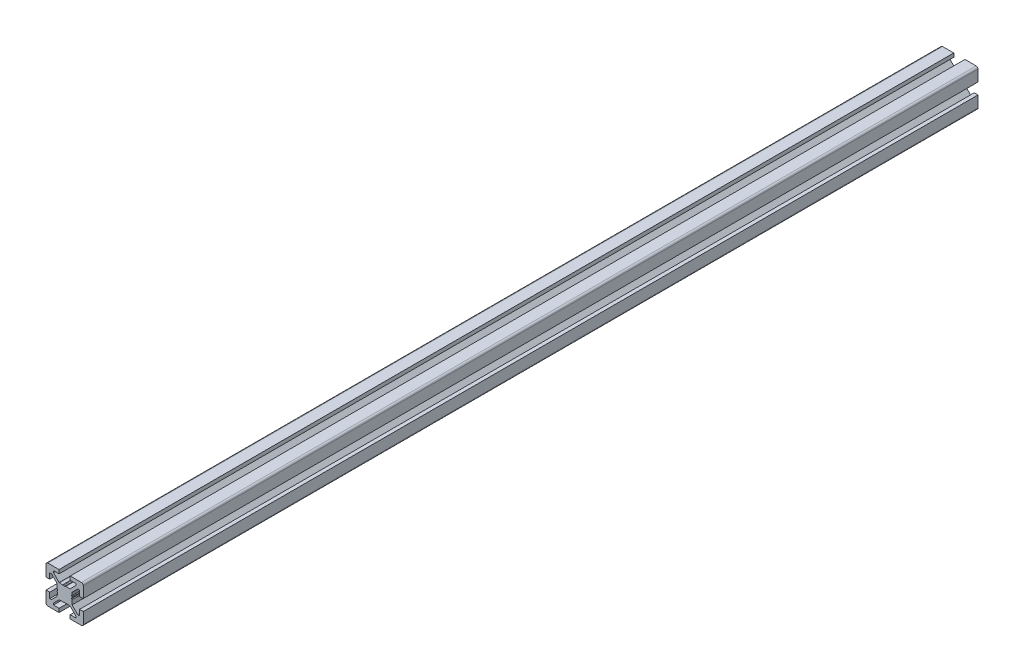
from build123d import *

# Parameters (mm, degrees)
SKETCH1_R           = 2.1
BOSS_EXTRUDE1_DEPTH = 400
EXTRUDE_1_DEPTH     = 20
EXTRUDE_2_DEPTH     = 60


with BuildPart() as part:
    # Sketch1 → Boss-Extrude1 (new body)
    with BuildSketch(Plane(origin=(0, 0, -2000), x_dir=(-1, 0, 0), z_dir=(0, 0, -1))):
        with BuildLine():
            Line((10, -3), (8, -3))
            Line((8, -3), (8, -6))
            Line((8, -6), (7.060660172, -6))
            Line((7.060660172, -6), (4, -2.939339828))
            Line((4, -2.939339828), (4, -2.5))
            Line((4, -2.5), (3.750976592, -1.218885629))
            Line((3.750976592, -1.218885629), (3.933012702, -0.903589838))
            ThreePointArc((3.933012702, -0.903589838), (4, -0.653589838), (3.933012702, -0.403589838))
            Line((3.933012702, -0.403589838), (3.7, 0))
            Line((3.7, 0), (3.933012702, 0.403589838))
            ThreePointArc((3.933012702, 0.403589838), (3.982962913, 0.524180316), (4, 0.653589838))
            Line((4, 0.653589838), (4, 2.939339828))
            Line((4, 2.939339828), (7.060660172, 6))
            Line((7.060660172, 6), (8, 6))
            Line((8, 6), (8, 3))
            Line((8, 3), (10, 3))
            Line((10, 3), (10, 9))
            ThreePointArc((10, 9), (9.707106781, 9.707106781), (9, 10))
            Line((9, 10), (3, 10))
            Line((3, 10), (3, 8))
            Line((3, 8), (6, 8))
            Line((6, 8), (6, 7.060660172))
            Line((6, 7.060660172), (2.939339828, 4))
            Line((2.939339828, 4), (2.5, 4))
            Line((2.5, 4), (1.218885629, 3.750976592))
            Line((1.218885629, 3.750976592), (0.903589838, 3.933012702))
            ThreePointArc((0.903589838, 3.933012702), (0.653589838, 4), (0.403589838, 3.933012702))
            Line((0.403589838, 3.933012702), (0, 3.7))
            Line((0, 3.7), (-0.403589838, 3.933012702))
            ThreePointArc((-0.403589838, 3.933012702), (-0.524180316, 3.982962913), (-0.653589838, 4))
            Line((-0.653589838, 4), (-2.939339828, 4))
            Line((-2.939339828, 4), (-6, 7.060660172))
            Line((-6, 7.060660172), (-6, 8))
            Line((-6, 8), (-3, 8))
            Line((-3, 8), (-3, 10))
            Line((-3, 10), (-9, 10))
            ThreePointArc((-9, 10), (-9.707106781, 9.707106781), (-10, 9))
            Line((-10, 9), (-10, 3))
            Line((-10, 3), (-8, 3))
            Line((-8, 3), (-8, 6))
            Line((-8, 6), (-7.060660172, 6))
            Line((-7.060660172, 6), (-4, 2.939339828))
            Line((-4, 2.939339828), (-4, 2.5))
            Line((-4, 2.5), (-3.750976592, 1.218885629))
            Line((-3.750976592, 1.218885629), (-3.933012702, 0.903589838))
            ThreePointArc((-3.933012702, 0.903589838), (-4, 0.653589838), (-3.933012702, 0.403589838))
            Line((-3.933012702, 0.403589838), (-3.7, 0))
            Line((-3.7, 0), (-3.933012702, -0.403589838))
            ThreePointArc((-3.933012702, -0.403589838), (-3.982962913, -0.524180316), (-4, -0.653589838))
            Line((-4, -0.653589838), (-4, -2.939339828))
            Line((-4, -2.939339828), (-7.060660172, -6))
            Line((-7.060660172, -6), (-8, -6))
            Line((-8, -6), (-8, -3))
            Line((-8, -3), (-10, -3))
            Line((-10, -3), (-10, -9))
            ThreePointArc((-10, -9), (-9.707106781, -9.707106781), (-9, -10))
            Line((-9, -10), (-3, -10))
            Line((-3, -10), (-3, -8))
            Line((-3, -8), (-6, -8))
            Line((-6, -8), (-6, -7.060660172))
            Line((-6, -7.060660172), (-2.939339828, -4))
            Line((-2.939339828, -4), (-2.5, -4))
            Line((-2.5, -4), (-1.218885629, -3.750976592))
            Line((-1.218885629, -3.750976592), (-0.903589838, -3.933012702))
            ThreePointArc((-0.903589838, -3.933012702), (-0.653589838, -4), (-0.403589838, -3.933012702))
            Line((-0.403589838, -3.933012702), (0, -3.7))
            Line((0, -3.7), (0.403589838, -3.933012702))
            ThreePointArc((0.403589838, -3.933012702), (0.524180316, -3.982962913), (0.653589838, -4))
            Line((0.653589838, -4), (2.939339828, -4))
            Line((2.939339828, -4), (6, -7.060660172))
            Line((6, -7.060660172), (6, -8))
            Line((6, -8), (3, -8))
            Line((3, -8), (3, -10))
            Line((3, -10), (9, -10))
            ThreePointArc((9, -10), (9.707106781, -9.707106781), (10, -9))
            Line((10, -9), (10, -3))
        make_face()
        with Locations(Location((0, 0, 0), (0, 0, 180))):
            Circle(SKETCH1_R, mode=Mode.SUBTRACT)
    extrude(amount=-BOSS_EXTRUDE1_DEPTH)

    # 草图1 → 凸台-拉伸1 (add)
    with BuildSketch(Plane.XY.offset(-1600)):
        with BuildLine():
            Line((-10, -3), (-10, -9))
            ThreePointArc((-10, -9), (-9.707106781, -9.707106781), (-9, -10))
            Line((-9, -10), (-3, -10))
            Line((-3, -10), (-3, -8))
            Line((-3, -8), (-6, -8))
            Line((-6, -8), (-6, -7.060660172))
            Line((-6, -7.060660172), (-2.939339828, -4))
            Line((-2.939339828, -4), (-0.653589838, -4))
            ThreePointArc((-0.653589838, -4), (-0.524180316, -3.982962913), (-0.403589838, -3.933012702))
            Line((-0.403589838, -3.933012702), (0, -3.7))
            Line((0, -3.7), (0.403589838, -3.933012702))
            ThreePointArc((0.403589838, -3.933012702), (0.653589838, -4), (0.903589838, -3.933012702))
            Line((0.903589838, -3.933012702), (1.218885629, -3.750976592))
            Line((1.218885629, -3.750976592), (2.5, -4))
            Line((2.5, -4), (2.939339828, -4))
            Line((2.939339828, -4), (6, -7.060660172))
            Line((6, -7.060660172), (6, -8))
            Line((6, -8), (3, -8))
            Line((3, -8), (3, -10))
            Line((3, -10), (9, -10))
            ThreePointArc((9, -10), (9.707106781, -9.707106781), (10, -9))
            Line((10, -9), (10, -3))
            Line((10, -3), (8, -3))
            Line((8, -3), (8, -6))
            Line((8, -6), (7.060660172, -6))
            Line((7.060660172, -6), (4, -2.939339828))
            Line((4, -2.939339828), (4, -0.653589838))
            ThreePointArc((4, -0.653589838), (3.982962913, -0.524180316), (3.933012702, -0.403589838))
            Line((3.933012702, -0.403589838), (3.7, 0))
            Line((3.7, 0), (3.933012702, 0.403589838))
            ThreePointArc((3.933012702, 0.403589838), (4, 0.653589838), (3.933012702, 0.903589838))
            Line((3.933012702, 0.903589838), (3.750976592, 1.218885629))
            Line((3.750976592, 1.218885629), (4, 2.5))
            Line((4, 2.5), (4, 2.939339828))
            Line((4, 2.939339828), (7.060660172, 6))
            Line((7.060660172, 6), (8, 6))
            Line((8, 6), (8, 3))
            Line((8, 3), (10, 3))
            Line((10, 3), (10, 9))
            ThreePointArc((10, 9), (9.707106781, 9.707106781), (9, 10))
            Line((9, 10), (3, 10))
            Line((3, 10), (3, 8))
            Line((3, 8), (6, 8))
            Line((6, 8), (6, 7.060660172))
            Line((6, 7.060660172), (2.939339828, 4))
            Line((2.939339828, 4), (0.653589838, 4))
            ThreePointArc((0.653589838, 4), (0.524180316, 3.982962913), (0.403589838, 3.933012702))
            Line((0.403589838, 3.933012702), (0, 3.7))
            Line((0, 3.7), (-0.403589838, 3.933012702))
            ThreePointArc((-0.403589838, 3.933012702), (-0.653589838, 4), (-0.903589838, 3.933012702))
            Line((-0.903589838, 3.933012702), (-1.218885629, 3.750976592))
            Line((-1.218885629, 3.750976592), (-2.5, 4))
            Line((-2.5, 4), (-2.939339828, 4))
            Line((-2.939339828, 4), (-6, 7.060660172))
            Line((-6, 7.060660172), (-6, 8))
            Line((-6, 8), (-3, 8))
            Line((-3, 8), (-3, 10))
            Line((-3, 10), (-9, 10))
            ThreePointArc((-9, 10), (-9.707106781, 9.707106781), (-10, 9))
            Line((-10, 9), (-10, 3))
            Line((-10, 3), (-8, 3))
            Line((-8, 3), (-8, 6))
            Line((-8, 6), (-7.060660172, 6))
            Line((-7.060660172, 6), (-4, 2.939339828))
            Line((-4, 2.939339828), (-4, 0.653589838))
            ThreePointArc((-4, 0.653589838), (-3.982962913, 0.524180316), (-3.933012702, 0.403589838))
            Line((-3.933012702, 0.403589838), (-3.7, 0))
            Line((-3.7, 0), (-3.933012702, -0.403589838))
            ThreePointArc((-3.933012702, -0.403589838), (-4, -0.653589838), (-3.933012702, -0.903589838))
            Line((-3.933012702, -0.903589838), (-3.750976592, -1.218885629))
            Line((-3.750976592, -1.218885629), (-4, -2.5))
            Line((-4, -2.5), (-4, -2.939339828))
            Line((-4, -2.939339828), (-7.060660172, -6))
            Line((-7.060660172, -6), (-8, -6))
            Line((-8, -6), (-8, -3))
            Line((-8, -3), (-10, -3))
        make_face()
    extrude(amount=EXTRUDE_1_DEPTH)

    # 草图2 → 凸台-拉伸2 (add)
    with BuildSketch(Plane.XY.offset(-1580)):
        with BuildLine():
            Line((-9, -10), (-3, -10))
            Line((-3, -10), (-3, -8))
            Line((-3, -8), (-6, -8))
            Line((-6, -8), (-6, -7.060660172))
            Line((-6, -7.060660172), (-2.939339828, -4))
            Line((-2.939339828, -4), (-0.653589838, -4))
            ThreePointArc((-0.653589838, -4), (-0.524180316, -3.982962913), (-0.403589838, -3.933012702))
            Line((-0.403589838, -3.933012702), (0, -3.7))
            Line((0, -3.7), (0.403589838, -3.933012702))
            ThreePointArc((0.403589838, -3.933012702), (0.653589838, -4), (0.903589838, -3.933012702))
            Line((0.903589838, -3.933012702), (1.218885629, -3.750976592))
            Line((1.218885629, -3.750976592), (2.5, -4))
            Line((2.5, -4), (2.939339828, -4))
            Line((2.939339828, -4), (6, -7.060660172))
            Line((6, -7.060660172), (6, -8))
            Line((6, -8), (3, -8))
            Line((3, -8), (3, -10))
            Line((3, -10), (9, -10))
            ThreePointArc((9, -10), (9.707106781, -9.707106781), (10, -9))
            Line((10, -9), (10, -3))
            Line((10, -3), (8, -3))
            Line((8, -3), (8, -6))
            Line((8, -6), (7.060660172, -6))
            Line((7.060660172, -6), (4, -2.939339828))
            Line((4, -2.939339828), (4, -0.653589838))
            ThreePointArc((4, -0.653589838), (3.982962913, -0.524180316), (3.933012702, -0.403589838))
            Line((3.933012702, -0.403589838), (3.7, 0))
            Line((3.7, 0), (3.933012702, 0.403589838))
            ThreePointArc((3.933012702, 0.403589838), (4, 0.653589838), (3.933012702, 0.903589838))
            Line((3.933012702, 0.903589838), (3.750976592, 1.218885629))
            Line((3.750976592, 1.218885629), (4, 2.5))
            Line((4, 2.5), (4, 2.939339828))
            Line((4, 2.939339828), (7.060660172, 6))
            Line((7.060660172, 6), (8, 6))
            Line((8, 6), (8, 3))
            Line((8, 3), (10, 3))
            Line((10, 3), (10, 9))
            ThreePointArc((10, 9), (9.707106781, 9.707106781), (9, 10))
            Line((9, 10), (3, 10))
            Line((3, 10), (3, 8))
            Line((3, 8), (6, 8))
            Line((6, 8), (6, 7.060660172))
            Line((6, 7.060660172), (2.939339828, 4))
            Line((2.939339828, 4), (0.653589838, 4))
            ThreePointArc((0.653589838, 4), (0.524180316, 3.982962913), (0.403589838, 3.933012702))
            Line((0.403589838, 3.933012702), (0, 3.7))
            Line((0, 3.7), (-0.403589838, 3.933012702))
            ThreePointArc((-0.403589838, 3.933012702), (-0.653589838, 4), (-0.903589838, 3.933012702))
            Line((-0.903589838, 3.933012702), (-1.218885629, 3.750976592))
            Line((-1.218885629, 3.750976592), (-2.5, 4))
            Line((-2.5, 4), (-2.939339828, 4))
            Line((-2.939339828, 4), (-6, 7.060660172))
            Line((-6, 7.060660172), (-6, 8))
            Line((-6, 8), (-3, 8))
            Line((-3, 8), (-3, 10))
            Line((-3, 10), (-9, 10))
            ThreePointArc((-9, 10), (-9.707106781, 9.707106781), (-10, 9))
            Line((-10, 9), (-10, 3))
            Line((-10, 3), (-8, 3))
            Line((-8, 3), (-8, 6))
            Line((-8, 6), (-7.060660172, 6))
            Line((-7.060660172, 6), (-4, 2.939339828))
            Line((-4, 2.939339828), (-4, 0.653589838))
            ThreePointArc((-4, 0.653589838), (-3.982962913, 0.524180316), (-3.933012702, 0.403589838))
            Line((-3.933012702, 0.403589838), (-3.7, 0))
            Line((-3.7, 0), (-3.933012702, -0.403589838))
            ThreePointArc((-3.933012702, -0.403589838), (-4, -0.653589838), (-3.933012702, -0.903589838))
            Line((-3.933012702, -0.903589838), (-3.750976592, -1.218885629))
            Line((-3.750976592, -1.218885629), (-4, -2.5))
            Line((-4, -2.5), (-4, -2.939339828))
            Line((-4, -2.939339828), (-7.060660172, -6))
            Line((-7.060660172, -6), (-8, -6))
            Line((-8, -6), (-8, -3))
            Line((-8, -3), (-10, -3))
            Line((-10, -3), (-10, -9))
            ThreePointArc((-10, -9), (-9.707106781, -9.707106781), (-9, -10))
        make_face()
    extrude(amount=EXTRUDE_2_DEPTH)


solid = part.part
